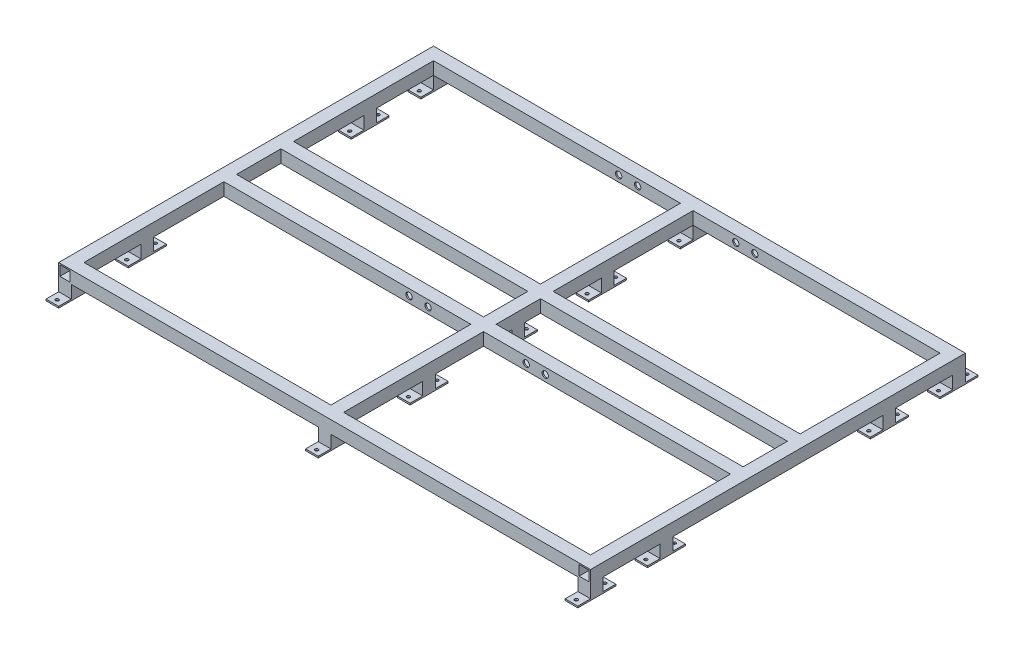
from build123d import *

# Parameters (mm, degrees)
SZKIC1_W                     = 40
SZKIC1_H                     = 40
SZKIC1_W_2                   = 32
SZKIC1_H_2                   = 32
DODANIE_WYCI_GNI_CIE1_DEPTH  = 592
DODANIE_WYCI_GNI_CIE3_REACH  = 1745.693
SZKIC4_W                     = 40
SZKIC4_H                     = 40
SZKIC4_W_2                   = 32
SZKIC4_H_2                   = 32
DODANIE_WYCI_GNI_CIE4_REACH  = 1745.693
SZKIC5_W                     = 40
SZKIC5_H                     = 40
SZKIC5_W_2                   = 32
SZKIC5_H_2                   = 32
DODANIE_WYCI_GNI_CIE5_REACH  = 1421.414
SZKIC6_W                     = 40
SZKIC6_H                     = 40
SZKIC6_W_2                   = 32
SZKIC6_H_2                   = 32
DODANIE_WYCI_GNI_CIE6_REACH  = 1046.253
SZKIC7_W                     = 40
SZKIC7_H                     = 40
SZKIC7_W_2                   = 32
SZKIC7_H_2                   = 32
LUSTRO7_COPY_1_REACH         = 1046.253
LUSTRO7_COPY_1_SKETCH_W      = 40
LUSTRO7_COPY_1_SKETCH_H      = 40
LUSTRO7_COPY_1_SKETCH_W_2    = 32
LUSTRO7_COPY_1_SKETCH_H_2    = 32
SZKIC8_W                     = 40
SZKIC8_H                     = 40
SZKIC8_W_2                   = 32
SZKIC8_H_2                   = 32
DODANIE_WYCI_GNI_CIE7_DEPTH  = 40
LUSTRO9_COPY_1_SKETCH_W      = 40
LUSTRO9_COPY_1_SKETCH_H      = 40
LUSTRO9_COPY_1_SKETCH_W_2    = 32
LUSTRO9_COPY_1_SKETCH_H_2    = 32
LUSTRO9_COPY_1_DEPTH         = 40
SZKIC9_W                     = 40
SZKIC9_H                     = 40
SZKIC9_W_2                   = 32
SZKIC9_H_2                   = 32
DODANIE_WYCI_GNI_CIE8_DEPTH  = 40
LUSTRO11_COPY_1_SKETCH_W     = 40
LUSTRO11_COPY_1_SKETCH_H     = 40
LUSTRO11_COPY_1_SKETCH_W_2   = 32
LUSTRO11_COPY_1_SKETCH_H_2   = 32
LUSTRO11_COPY_1_DEPTH        = 40
SZKIC10_W                    = 40
SZKIC10_H                    = 40
SZKIC10_W_2                  = 32
SZKIC10_H_2                  = 32
DODANIE_WYCI_GNI_CIE9_DEPTH  = 40
SZKIC12_W                    = 40
SZKIC12_H                    = 40
SZKIC12_W_2                  = 32
SZKIC12_H_2                  = 32
DODANIE_WYCI_GNI_CIE10_DEPTH = 40
SZKIC13_W                    = 40
SZKIC13_H                    = 40
SZKIC13_W_2                  = 32
SZKIC13_H_2                  = 32
DODANIE_WYCI_GNI_CIE11_DEPTH = 40
SZKIC14_W                    = 40
SZKIC14_H                    = 120
SZKIC14_R                    = 5
DODANIE_WYCI_GNI_CIE12_DEPTH = 5
LUSTRO15_COPY_1_SKETCH_W     = 40
LUSTRO15_COPY_1_SKETCH_H     = 120
LUSTRO15_COPY_1_SKETCH_R     = 5
LUSTRO15_COPY_1_DEPTH        = 5
LUSTRO15_COPY_2_SKETCH_W     = 40
LUSTRO15_COPY_2_SKETCH_H     = 120
LUSTRO15_COPY_2_SKETCH_R     = 5
LUSTRO15_COPY_2_DEPTH        = 5
LUSTRO16_COPY_1_SKETCH_W     = 40
LUSTRO16_COPY_1_SKETCH_H     = 120
LUSTRO16_COPY_1_SKETCH_R     = 5
LUSTRO16_COPY_1_DEPTH        = 5
LUSTRO16_COPY_2_SKETCH_W     = 40
LUSTRO16_COPY_2_SKETCH_H     = 120
LUSTRO16_COPY_2_SKETCH_R     = 5
LUSTRO16_COPY_2_DEPTH        = 5
LUSTRO16_COPY_3_SKETCH_W     = 40
LUSTRO16_COPY_3_SKETCH_H     = 120
LUSTRO16_COPY_3_SKETCH_R     = 5
LUSTRO16_COPY_3_DEPTH        = 5
LUSTRO16_COPY_4_SKETCH_W     = 40
LUSTRO16_COPY_4_SKETCH_H     = 120
LUSTRO16_COPY_4_SKETCH_R     = 5
LUSTRO16_COPY_4_DEPTH        = 5
LUSTRO17_COPY_1_SKETCH_W     = 40
LUSTRO17_COPY_1_SKETCH_H     = 120
LUSTRO17_COPY_1_SKETCH_R     = 5
LUSTRO17_COPY_1_DEPTH        = 5
SZKIC15_W                    = 40
SZKIC15_H                    = 120
SZKIC15_R                    = 5
DODANIE_WYCI_GNI_CIE13_DEPTH = 5
SZKIC16_R                    = 10
WYTNIJ_WYCI_GNI_CIE1_DEPTH   = 10
LUSTRO21_COPY_1_SKETCH_R     = 10
LUSTRO21_COPY_1_DEPTH        = 10
LUSTRO22_COPY_1_SKETCH_R     = 10
LUSTRO22_COPY_1_DEPTH        = 10
LUSTRO22_COPY_2_SKETCH_R     = 10
LUSTRO22_COPY_2_DEPTH        = 10
LUSTRO22_COPY_3_SKETCH_R     = 10
LUSTRO22_COPY_3_DEPTH        = 10


with BuildPart() as part:
    # Szkic1 → Dodanie-wyciągnięcie1 (new, symmetric)
    with BuildSketch(Plane.XY):
        with Locations((-820, 0)):
            Rectangle(SZKIC1_W, SZKIC1_H)
        with Locations((-820, 0)):
            Rectangle(SZKIC1_W_2, SZKIC1_H_2, mode=Mode.SUBTRACT)
    extrude(amount=DODANIE_WYCI_GNI_CIE1_DEPTH, both=True)


with BuildPart() as body_2:
    # Lustro4: mirrored copy
    add(part.part.mirror(Plane(origin=(0, 0, 0), x_dir=(0, 0, 1), z_dir=(1, 0, 0))))

    # Szkic4 → Dodanie-wyciągnięcie3 (add, up to next)
    with BuildSketch(Plane(origin=(-800, 0, 0), x_dir=(0, 0, -1), z_dir=(1, 0, 0)), mode=Mode.PRIVATE) as dodanie_wyci_gni_cie3_sk1:
        with Locations((-572, 0)):
            Rectangle(SZKIC4_W, SZKIC4_H)
        with Locations((-572, 0)):
            Rectangle(SZKIC4_W_2, SZKIC4_H_2, mode=Mode.SUBTRACT)
    dodanie_wyci_gni_cie3_tool1 = extrude(dodanie_wyci_gni_cie3_sk1.sketch, amount=DODANIE_WYCI_GNI_CIE3_REACH, mode=Mode.PRIVATE) - body_2.part

    add(part.part)  # Dodanie-wyciągnięcie3 merges part
    add(dodanie_wyci_gni_cie3_tool1.solids().sort_by_distance((-800, 19.434315, 572))[0])

    # Szkic5 → Dodanie-wyciągnięcie4 (add, up to next)
    with BuildSketch(Plane(origin=(-800, 0, 0), x_dir=(0, 0, -1), z_dir=(1, 0, 0)), mode=Mode.PRIVATE) as dodanie_wyci_gni_cie4_sk1:
        with Locations((572, 0)):
            Rectangle(SZKIC5_W, SZKIC5_H)
        with Locations((572, 0)):
            Rectangle(SZKIC5_W_2, SZKIC5_H_2, mode=Mode.SUBTRACT)
    dodanie_wyci_gni_cie4_tool1 = extrude(dodanie_wyci_gni_cie4_sk1.sketch, amount=DODANIE_WYCI_GNI_CIE4_REACH, mode=Mode.PRIVATE) - body_2.part
    add(dodanie_wyci_gni_cie4_tool1.solids().sort_by_distance((-800, 19.434315, -572))[0])

    # Szkic6 → Dodanie-wyciągnięcie5 (add, up to next)
    with BuildSketch(Plane(origin=(0, 0, 552), x_dir=(-1, 0, 0), z_dir=(0, 0, -1)), mode=Mode.PRIVATE) as dodanie_wyci_gni_cie5_sk1:
        Rectangle(SZKIC6_W, SZKIC6_H)
        Rectangle(SZKIC6_W_2, SZKIC6_H_2, mode=Mode.SUBTRACT)
    dodanie_wyci_gni_cie5_tool1 = extrude(dodanie_wyci_gni_cie5_sk1.sketch, amount=DODANIE_WYCI_GNI_CIE5_REACH, mode=Mode.PRIVATE) - body_2.part
    add(dodanie_wyci_gni_cie5_tool1.solids().sort_by_distance((0, -19.434315, 552))[0])

    # Szkic7 → Dodanie-wyciągnięcie6 (add, up to next)
    with BuildSketch(Plane(origin=(20, 0, 0), x_dir=(0, 0, -1), z_dir=(1, 0, 0)), mode=Mode.PRIVATE) as dodanie_wyci_gni_cie6_sk1:
        with Locations((90, 0)):
            Rectangle(SZKIC7_W, SZKIC7_H)
        with Locations((90, 0)):
            Rectangle(SZKIC7_W_2, SZKIC7_H_2, mode=Mode.SUBTRACT)
    dodanie_wyci_gni_cie6_tool1 = extrude(dodanie_wyci_gni_cie6_sk1.sketch, amount=DODANIE_WYCI_GNI_CIE6_REACH, mode=Mode.PRIVATE) - body_2.part
    dodanie_wyci_gni_cie6 = dodanie_wyci_gni_cie6_tool1.solids().sort_by_distance((20, -19.434315, -90))[0]
    add(dodanie_wyci_gni_cie6)

    # Lustro6: Dodanie-wyciągnięcie6 across plane
    add(dodanie_wyci_gni_cie6.mirror(Plane.XY))

    # Lustro7: Dodanie-wyciągnięcie6 across plane
    add(dodanie_wyci_gni_cie6.mirror(Plane(origin=(0, 0, 0), x_dir=(0, 0, 1), z_dir=(1, 0, 0))))

    # Lustro7 copy 1 sketch → Lustro7 copy 1 (add, up to next)
    with BuildSketch(Plane.ZY.offset(20), mode=Mode.PRIVATE) as lustro7_copy_1_sk1:
        with Locations((90, 0)):
            Rectangle(LUSTRO7_COPY_1_SKETCH_W, LUSTRO7_COPY_1_SKETCH_H)
        with Locations((90, 0)):
            Rectangle(LUSTRO7_COPY_1_SKETCH_W_2, LUSTRO7_COPY_1_SKETCH_H_2, mode=Mode.SUBTRACT)
    lustro7_copy_1_tool1 = extrude(lustro7_copy_1_sk1.sketch, amount=LUSTRO7_COPY_1_REACH, mode=Mode.PRIVATE) - body_2.part
    add(lustro7_copy_1_tool1.solids().sort_by_distance((-20, -19.434315, 90))[0])

    # Szkic8 → Dodanie-wyciągnięcie7 (add)
    with BuildSketch(Plane.XZ.offset(20)):
        with Locations((-820, 572)):
            Rectangle(SZKIC8_W, SZKIC8_H)
        with Locations((-820, 572)):
            Rectangle(SZKIC8_W_2, SZKIC8_H_2, mode=Mode.SUBTRACT)
    dodanie_wyci_gni_cie7 = extrude(amount=DODANIE_WYCI_GNI_CIE7_DEPTH)

    # Lustro8: Dodanie-wyciągnięcie7 across plane
    add(dodanie_wyci_gni_cie7.mirror(Plane.XY))

    # Lustro9: Dodanie-wyciągnięcie7 across plane
    add(dodanie_wyci_gni_cie7.mirror(Plane(origin=(0, 0, 0), x_dir=(0, 0, 1), z_dir=(1, 0, 0))))

    # Lustro9 copy 1 sketch → Lustro9 copy 1 (add)
    with BuildSketch(Plane(origin=(0, -20, 0), x_dir=(-1, 0, 0), z_dir=(0, -1, 0))):
        with Locations((-820, 572)):
            Rectangle(LUSTRO9_COPY_1_SKETCH_W, LUSTRO9_COPY_1_SKETCH_H)
        with Locations((-820, 572)):
            Rectangle(LUSTRO9_COPY_1_SKETCH_W_2, LUSTRO9_COPY_1_SKETCH_H_2, mode=Mode.SUBTRACT)
    extrude(amount=LUSTRO9_COPY_1_DEPTH)

    # Szkic9 → Dodanie-wyciągnięcie8 (add)
    with BuildSketch(Plane.XZ.offset(20)):
        with Locations((-820, 352)):
            Rectangle(SZKIC9_W, SZKIC9_H)
        with Locations((-820, 352)):
            Rectangle(SZKIC9_W_2, SZKIC9_H_2, mode=Mode.SUBTRACT)
    dodanie_wyci_gni_cie8 = extrude(amount=DODANIE_WYCI_GNI_CIE8_DEPTH)

    # Lustro10: Dodanie-wyciągnięcie8 across plane
    add(dodanie_wyci_gni_cie8.mirror(Plane.XY))

    # Lustro11: Dodanie-wyciągnięcie8 across plane
    add(dodanie_wyci_gni_cie8.mirror(Plane(origin=(0, 0, 0), x_dir=(0, 0, 1), z_dir=(1, 0, 0))))

    # Lustro11 copy 1 sketch → Lustro11 copy 1 (add)
    with BuildSketch(Plane(origin=(0, -20, 0), x_dir=(-1, 0, 0), z_dir=(0, -1, 0))):
        with Locations((-820, 352)):
            Rectangle(LUSTRO11_COPY_1_SKETCH_W, LUSTRO11_COPY_1_SKETCH_H)
        with Locations((-820, 352)):
            Rectangle(LUSTRO11_COPY_1_SKETCH_W_2, LUSTRO11_COPY_1_SKETCH_H_2, mode=Mode.SUBTRACT)
    extrude(amount=LUSTRO11_COPY_1_DEPTH)

    # Szkic10 → Dodanie-wyciągnięcie9 (add)
    with BuildSketch(Plane.XZ.offset(20)):
        with Locations((0, 572)):
            Rectangle(SZKIC10_W, SZKIC10_H)
        with Locations((0, 572)):
            Rectangle(SZKIC10_W_2, SZKIC10_H_2, mode=Mode.SUBTRACT)
    dodanie_wyci_gni_cie9 = extrude(amount=DODANIE_WYCI_GNI_CIE9_DEPTH)

    # Szkic12 → Dodanie-wyciągnięcie10 (add)
    with BuildSketch(Plane.XZ.offset(20)):
        with Locations((0, 282)):
            Rectangle(SZKIC12_W, SZKIC12_H)
        with Locations((0, 282)):
            Rectangle(SZKIC12_W_2, SZKIC12_H_2, mode=Mode.SUBTRACT)
    dodanie_wyci_gni_cie10 = extrude(amount=DODANIE_WYCI_GNI_CIE10_DEPTH)

    # Lustro12: Dodanie-wyciągnięcie9, Dodanie-wyciągnięcie10 across plane
    add(dodanie_wyci_gni_cie9.mirror(Plane.XY))
    add(dodanie_wyci_gni_cie10.mirror(Plane.XY))

    # Szkic13 → Dodanie-wyciągnięcie11 (add)
    with BuildSketch(Plane.XZ.offset(20)):
        Rectangle(SZKIC13_W, SZKIC13_H)
        Rectangle(SZKIC13_W_2, SZKIC13_H_2, mode=Mode.SUBTRACT)
    extrude(amount=DODANIE_WYCI_GNI_CIE11_DEPTH)

    # Szkic14 → Dodanie-wyciągnięcie12 (add)
    with BuildSketch(Plane.XZ.offset(60)):
        with Locations((820, -572)):
            Rectangle(SZKIC14_W, SZKIC14_H)
        with Locations(Location((820, -527, 0), (0, 0, 270))):
            Circle(SZKIC14_R, mode=Mode.SUBTRACT)
        with Locations(Location((820, -617, 0), (0, 0, 270))):
            Circle(SZKIC14_R, mode=Mode.SUBTRACT)
    dodanie_wyci_gni_cie12 = extrude(amount=DODANIE_WYCI_GNI_CIE12_DEPTH)

    # Lustro13: Dodanie-wyciągnięcie12 across plane
    add(dodanie_wyci_gni_cie12.mirror(Plane.XY))

    # Lustro14: Dodanie-wyciągnięcie12 across plane
    add(dodanie_wyci_gni_cie12.mirror(Plane.XY.offset(-462)))

    # Lustro15 copy 1 sketch → Lustro15 copy 1 (add)
    with BuildSketch(Plane(origin=(0, -60, 924), x_dir=(1, 0, 0), z_dir=(0, -1, 0))):
        with Locations((820, -572)):
            Rectangle(LUSTRO15_COPY_1_SKETCH_W, LUSTRO15_COPY_1_SKETCH_H)
        with Locations(Location((820, -527, 0), (0, 0, 270))):
            Circle(LUSTRO15_COPY_1_SKETCH_R, mode=Mode.SUBTRACT)
        with Locations(Location((820, -617, 0), (0, 0, 270))):
            Circle(LUSTRO15_COPY_1_SKETCH_R, mode=Mode.SUBTRACT)
    extrude(amount=LUSTRO15_COPY_1_DEPTH)

    # Lustro15 copy 2 sketch → Lustro15 copy 2 (add)
    with BuildSketch(Plane.XZ.offset(60)):
        with Locations((820, 572)):
            Rectangle(LUSTRO15_COPY_2_SKETCH_W, LUSTRO15_COPY_2_SKETCH_H)
        with Locations((820, 527)):
            Circle(LUSTRO15_COPY_2_SKETCH_R, mode=Mode.SUBTRACT)
        with Locations((820, 617)):
            Circle(LUSTRO15_COPY_2_SKETCH_R, mode=Mode.SUBTRACT)
    extrude(amount=LUSTRO15_COPY_2_DEPTH)

    # Lustro16: Dodanie-wyciągnięcie12 across plane
    add(dodanie_wyci_gni_cie12.mirror(Plane(origin=(0, 0, 0), x_dir=(0, 0, 1), z_dir=(1, 0, 0))))

    # Lustro16 copy 1 sketch → Lustro16 copy 1 (add)
    with BuildSketch(Plane(origin=(0, -60, 0), x_dir=(-1, 0, 0), z_dir=(0, -1, 0))):
        with Locations((820, -572)):
            Rectangle(LUSTRO16_COPY_1_SKETCH_W, LUSTRO16_COPY_1_SKETCH_H)
        with Locations(Location((820, -527, 0), (0, 0, 270))):
            Circle(LUSTRO16_COPY_1_SKETCH_R, mode=Mode.SUBTRACT)
        with Locations(Location((820, -617, 0), (0, 0, 270))):
            Circle(LUSTRO16_COPY_1_SKETCH_R, mode=Mode.SUBTRACT)
    extrude(amount=LUSTRO16_COPY_1_DEPTH)

    # Lustro16 copy 2 sketch → Lustro16 copy 2 (add)
    with BuildSketch(Plane(origin=(0, -60, -924), x_dir=(-1, 0, 0), z_dir=(0, -1, 0))):
        with Locations((820, -572)):
            Rectangle(LUSTRO16_COPY_2_SKETCH_W, LUSTRO16_COPY_2_SKETCH_H)
        with Locations(Location((820, -527, 0), (0, 0, 270))):
            Circle(LUSTRO16_COPY_2_SKETCH_R, mode=Mode.SUBTRACT)
        with Locations(Location((820, -617, 0), (0, 0, 270))):
            Circle(LUSTRO16_COPY_2_SKETCH_R, mode=Mode.SUBTRACT)
    extrude(amount=LUSTRO16_COPY_2_DEPTH)

    # Lustro16 copy 3 sketch → Lustro16 copy 3 (add)
    with BuildSketch(Plane(origin=(0, -60, 924), x_dir=(-1, 0, 0), z_dir=(0, -1, 0))):
        with Locations((820, 572)):
            Rectangle(LUSTRO16_COPY_3_SKETCH_W, LUSTRO16_COPY_3_SKETCH_H)
        with Locations((820, 527)):
            Circle(LUSTRO16_COPY_3_SKETCH_R, mode=Mode.SUBTRACT)
        with Locations((820, 617)):
            Circle(LUSTRO16_COPY_3_SKETCH_R, mode=Mode.SUBTRACT)
    extrude(amount=LUSTRO16_COPY_3_DEPTH)

    # Lustro16 copy 4 sketch → Lustro16 copy 4 (add)
    with BuildSketch(Plane(origin=(0, -60, 0), x_dir=(-1, 0, 0), z_dir=(0, -1, 0))):
        with Locations((820, -572)):
            Rectangle(LUSTRO16_COPY_4_SKETCH_W, LUSTRO16_COPY_4_SKETCH_H)
        with Locations(Location((820, -527, 0), (0, 0, 270))):
            Circle(LUSTRO16_COPY_4_SKETCH_R, mode=Mode.SUBTRACT)
        with Locations(Location((820, -617, 0), (0, 0, 270))):
            Circle(LUSTRO16_COPY_4_SKETCH_R, mode=Mode.SUBTRACT)
    extrude(amount=LUSTRO16_COPY_4_DEPTH)

    # Lustro17: Dodanie-wyciągnięcie12 across plane
    add(dodanie_wyci_gni_cie12.mirror(Plane.ZY.offset(-410)))

    # Lustro17 copy 1 sketch → Lustro17 copy 1 (add)
    with BuildSketch(Plane(origin=(820, -60, 0), x_dir=(-1, 0, 0), z_dir=(0, -1, 0))):
        with Locations((820, -572)):
            Rectangle(LUSTRO17_COPY_1_SKETCH_W, LUSTRO17_COPY_1_SKETCH_H)
        with Locations(Location((820, -527, 0), (0, 0, 270))):
            Circle(LUSTRO17_COPY_1_SKETCH_R, mode=Mode.SUBTRACT)
        with Locations(Location((820, -617, 0), (0, 0, 270))):
            Circle(LUSTRO17_COPY_1_SKETCH_R, mode=Mode.SUBTRACT)
    extrude(amount=LUSTRO17_COPY_1_DEPTH)

    # Szkic15 → Dodanie-wyciągnięcie13 (add)
    with BuildSketch(Plane.XZ.offset(60)):
        with Locations((0, -282)):
            Rectangle(SZKIC15_W, SZKIC15_H)
        with Locations(Location((0, -237, 0), (0, 0, 270))):
            Circle(SZKIC15_R, mode=Mode.SUBTRACT)
        with Locations(Location((0, -327, 0), (0, 0, 270))):
            Circle(SZKIC15_R, mode=Mode.SUBTRACT)
    dodanie_wyci_gni_cie13 = extrude(amount=DODANIE_WYCI_GNI_CIE13_DEPTH)

    # Lustro18: Dodanie-wyciągnięcie13 across plane
    add(dodanie_wyci_gni_cie13.mirror(Plane.XY))

    # Lustro19: Dodanie-wyciągnięcie13 across plane
    add(dodanie_wyci_gni_cie13.mirror(Plane(origin=(0, 0, -141), x_dir=(1, 0, 0), z_dir=(0, 0, -1))))

    # Szkic16 → Wytnij-wyciągnięcie1 (cut)
    with BuildSketch(Plane(origin=(0, 0, 552), x_dir=(-1, 0, 0), z_dir=(0, 0, -1))):
        with Locations((155, 0)):
            Circle(SZKIC16_R)
        with Locations((215, 0)):
            Circle(SZKIC16_R)
    wytnij_wyci_gni_cie1 = extrude(amount=-WYTNIJ_WYCI_GNI_CIE1_DEPTH, mode=Mode.SUBTRACT)

    # Lustro20: Wytnij-wyciągnięcie1 across plane
    add(wytnij_wyci_gni_cie1.mirror(Plane(origin=(0, 0, 331), x_dir=(1, 0, 0), z_dir=(0, 0, -1))), mode=Mode.SUBTRACT)

    # Lustro21: Wytnij-wyciągnięcie1 across plane
    add(wytnij_wyci_gni_cie1.mirror(Plane.XY), mode=Mode.SUBTRACT)

    # Lustro21 copy 1 sketch → Lustro21 copy 1 (cut)
    with BuildSketch(Plane(origin=(0, 0, -110), x_dir=(-1, 0, 0), z_dir=(0, 0, -1))):
        with Locations((155, 0)):
            Circle(LUSTRO21_COPY_1_SKETCH_R)
        with Locations((215, 0)):
            Circle(LUSTRO21_COPY_1_SKETCH_R)
    extrude(amount=-LUSTRO21_COPY_1_DEPTH, mode=Mode.SUBTRACT)

    # Lustro22: Wytnij-wyciągnięcie1 across plane
    add(wytnij_wyci_gni_cie1.mirror(Plane(origin=(0, 0, 0), x_dir=(0, 0, 1), z_dir=(1, 0, 0))), mode=Mode.SUBTRACT)

    # Lustro22 copy 1 sketch → Lustro22 copy 1 (cut)
    with BuildSketch(Plane.XY.offset(110)):
        with Locations((155, 0)):
            Circle(LUSTRO22_COPY_1_SKETCH_R)
        with Locations((215, 0)):
            Circle(LUSTRO22_COPY_1_SKETCH_R)
    extrude(amount=-LUSTRO22_COPY_1_DEPTH, mode=Mode.SUBTRACT)

    # Lustro22 copy 2 sketch → Lustro22 copy 2 (cut)
    with BuildSketch(Plane.XY.offset(-552)):
        with Locations((155, 0)):
            Circle(LUSTRO22_COPY_2_SKETCH_R)
        with Locations((215, 0)):
            Circle(LUSTRO22_COPY_2_SKETCH_R)
    extrude(amount=-LUSTRO22_COPY_2_DEPTH, mode=Mode.SUBTRACT)

    # Lustro22 copy 3 sketch → Lustro22 copy 3 (cut)
    with BuildSketch(Plane(origin=(0, 0, -110), x_dir=(1, 0, 0), z_dir=(0, 0, -1))):
        with Locations((155, 0)):
            Circle(LUSTRO22_COPY_3_SKETCH_R)
        with Locations((215, 0)):
            Circle(LUSTRO22_COPY_3_SKETCH_R)
    extrude(amount=-LUSTRO22_COPY_3_DEPTH, mode=Mode.SUBTRACT)


solid = body_2.part
